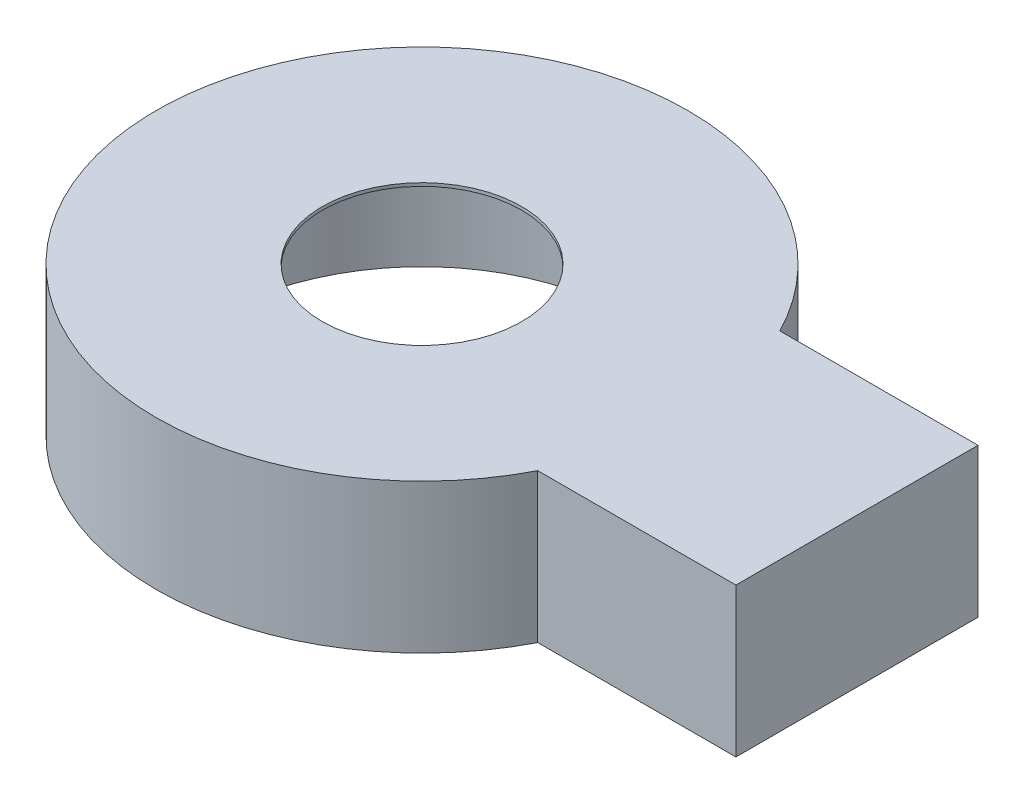
from build123d import *

# Parameters (mm, degrees)
SKETCH3_R           = 2.38125
BOSS_EXTRUDE1_DEPTH = 3.556
CUT_EXTRUDE1_START  = -3.4798
SKETCH4_R           = 2.38125
CUT_EXTRUDE1_DEPTH  = 3.4798


with BuildPart() as part:
    # Sketch3 → Boss-Extrude1 (new body)
    with BuildSketch(Plane(origin=(0, 0, 0), x_dir=(1, 0, 0), z_dir=(0, 1, 0))):
        with BuildLine():
            Line((5.654009559, -2.890445624), (8.020116475, -2.890445624))
            Line((8.020116475, -2.890445624), (10.386223391, -2.890445624))
            Line((10.386223391, -2.890445624), (10.386223391, 2.890445624))
            Line((10.386223391, 2.890445624), (8.020116475, 2.890445624))
            Line((8.020116475, 2.890445624), (5.654009559, 2.890445624))
            ThreePointArc((5.654009559, 2.890445624), (-6.35, 0), (5.654009559, -2.890445624))
        make_face()
        Circle(SKETCH3_R, mode=Mode.SUBTRACT)
    extrude(amount=-BOSS_EXTRUDE1_DEPTH)

    # Sketch4 → Cut-Extrude1 (cut)
    with BuildSketch(Plane(origin=(0, -3.556, 0), x_dir=(-1, 0, 0), z_dir=(0, -1, 0)).offset(CUT_EXTRUDE1_START)):
        with BuildLine():
            ThreePointArc((4.936299023, -0.4064), (0.463581133, 4.931257602), (-4.925553828, 0.5207))
            Line((-4.925553828, 0.5207), (-7.402053828, 0.5207))
            Line((-7.402053828, 0.5207), (-9.878553828, 0.5207))
            Line((-9.878553828, 0.5207), (-9.878553828, -0.5207))
            Line((-9.878553828, -0.5207), (-7.402053828, -0.5207))
            Line((-7.402053828, -0.5207), (-4.925553828, -0.5207))
            ThreePointArc((-4.925553828, -0.5207), (0.05740198, -4.952667363), (4.936299023, -0.4064))
        make_face()
        Circle(SKETCH4_R, mode=Mode.SUBTRACT)
    extrude(amount=CUT_EXTRUDE1_DEPTH, mode=Mode.SUBTRACT)


solid = part.part
